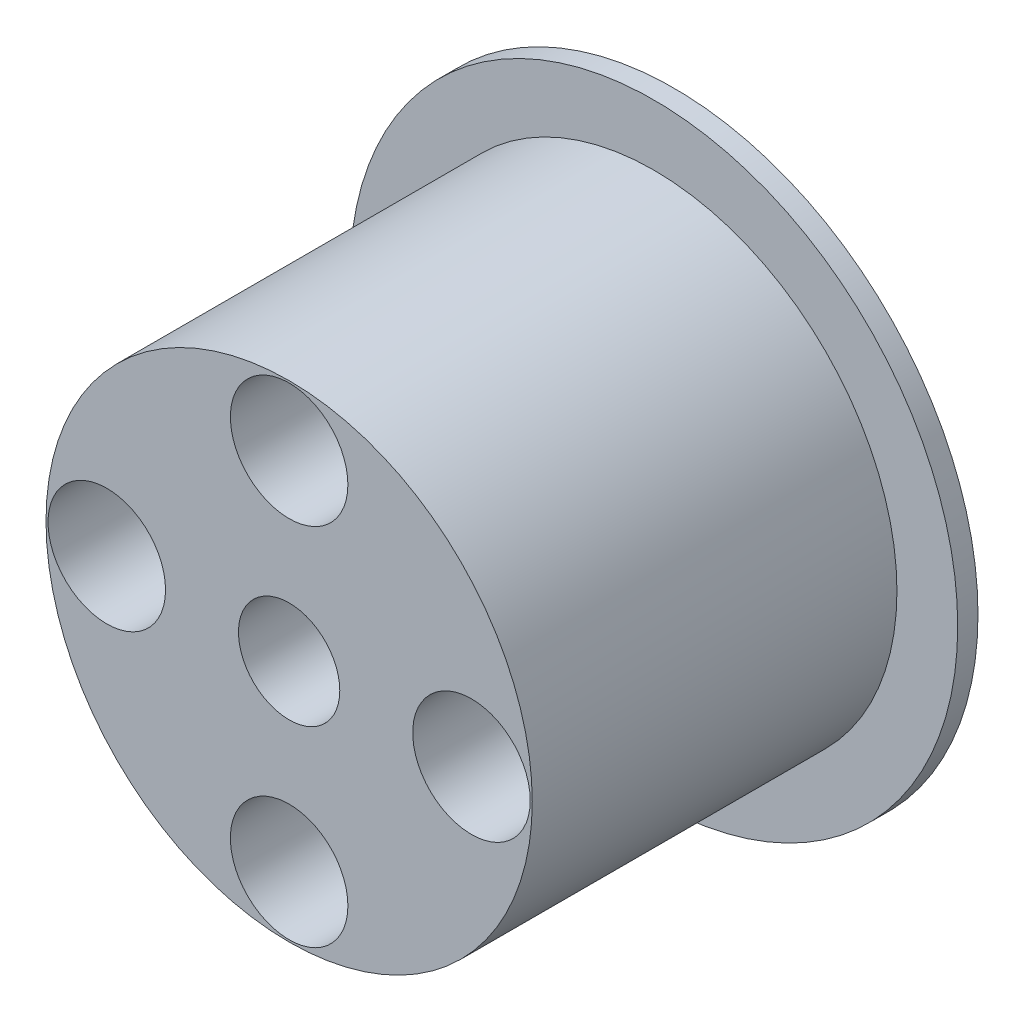
from build123d import *
from build123d.topology import SkipClean

# Parameters (mm, degrees)
SKIZZE1_R                       = 12
SKIZZE1_R_2                     = 1.5
AUFSATZ_LINEAR_AUSTRAGEN1_DEPTH = 18
AUFSATZ_LINEAR_START            = 1
SKIZZE4_R                       = 15
SKIZZE4_R_2                     = 1.5
AUFSATZ_LINEAR_AUSTRAGEN2_DEPTH = 1
SKIZZE2_R                       = 2.9
SCHNITT_LINEAR_AUSTRAGEN4_DEPTH = 14
SCHNITT_LINEAR_AUSTRAGEN5_DEPTH = 23
SKIZZE9_R                       = 2.5
SCHNITT_LINEAR_AUSTRAGEN7_DEPTH = 5


with BuildPart() as part:
    # Skizze1 → Aufsatz-Linear austragen1 (new body)
    with BuildSketch(Plane.XY):
        Circle(SKIZZE1_R)
        with Locations((9, 0)):
            Circle(SKIZZE1_R_2, mode=Mode.SUBTRACT)
        with Locations((0, -9)):
            Circle(SKIZZE1_R_2, mode=Mode.SUBTRACT)
        with Locations((-9, 0)):
            Circle(SKIZZE1_R_2, mode=Mode.SUBTRACT)
        with Locations((0, 9)):
            Circle(SKIZZE1_R_2, mode=Mode.SUBTRACT)
    extrude(amount=AUFSATZ_LINEAR_AUSTRAGEN1_DEPTH)

    # Skizze4 → Aufsatz-Linear austragen2 (add)
    with SkipClean():  # the faces are left unmerged after this step: merging them gives an invalid solid
        with BuildSketch(Plane(origin=(0, 0, 0), x_dir=(-1, 0, 0), z_dir=(0, 0, -1)).offset(AUFSATZ_LINEAR_START)):
            Circle(SKIZZE4_R)
            with Locations((0, 9)):
                Circle(SKIZZE4_R_2, mode=Mode.SUBTRACT)
            with Locations((9, 0)):
                Circle(SKIZZE4_R_2, mode=Mode.SUBTRACT)
            with Locations((0, -9)):
                Circle(SKIZZE4_R_2, mode=Mode.SUBTRACT)
            with Locations((-9, 0)):
                Circle(SKIZZE4_R_2, mode=Mode.SUBTRACT)
        extrude(amount=-AUFSATZ_LINEAR_AUSTRAGEN2_DEPTH)

    # Skizze2 → Schnitt-Linear austragen4 (cut)
    with BuildSketch(Plane.XY.offset(18)):
        with Locations((0, 9)):
            Circle(SKIZZE2_R)
        with Locations((9, 0)):
            Circle(SKIZZE2_R)
        with Locations((0, -9)):
            Circle(SKIZZE2_R)
        with Locations((-9, 0)):
            Circle(SKIZZE2_R)
    extrude(amount=-SCHNITT_LINEAR_AUSTRAGEN4_DEPTH, mode=Mode.SUBTRACT)

    # Skizze6 → Schnitt-Linear austragen5 (cut)
    with BuildSketch(Plane.XY.offset(18)):
        with BuildLine():
            Line((1.5, 2), (-1.5, 2))
            ThreePointArc((-1.5, 2), (-1.118033989, -2.236067977), (2.5, 0))
            ThreePointArc((2.5, 0), (2.236067977, 1.118033989), (1.5, 2))
        make_face()
    extrude(amount=-SCHNITT_LINEAR_AUSTRAGEN5_DEPTH, mode=Mode.SUBTRACT)

    # Skizze9 → Schnitt-Linear austragen7 (cut)
    with BuildSketch(Plane.XY.offset(18)):
        Circle(SKIZZE9_R)
    extrude(amount=-SCHNITT_LINEAR_AUSTRAGEN7_DEPTH, mode=Mode.SUBTRACT)


solid = part.part
